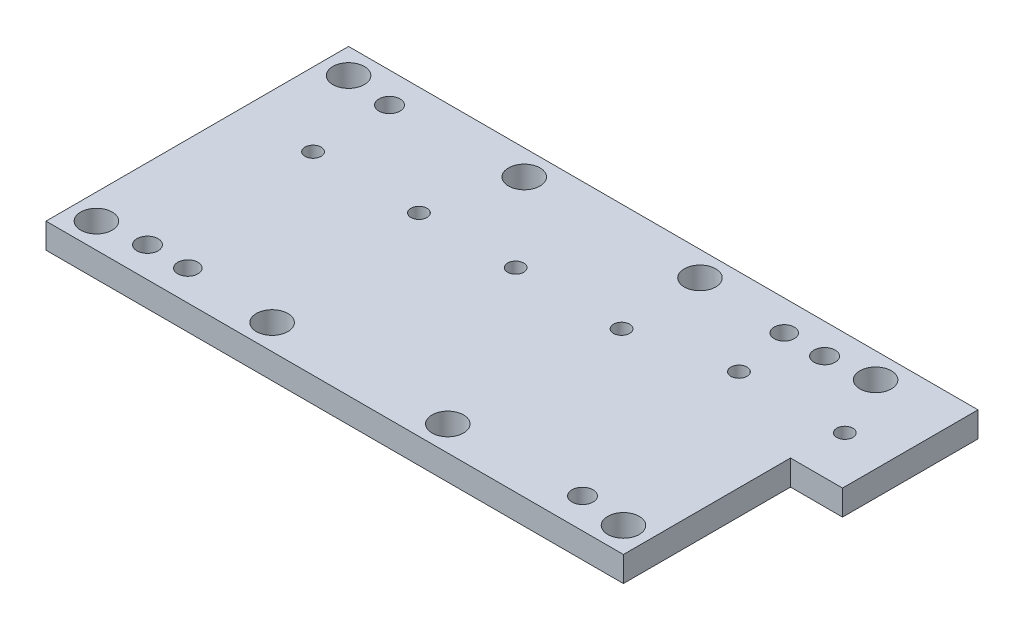
from build123d import *

# Parameters (mm, degrees)
SKETCH1_W                    = 229
SKETCH1_H                    = 120
BOSS_EXTRUDE1_DEPTH          = 10
SKETCH2_W                    = 20.632503002
SKETCH2_H                    = 53.730004003
BOSS_EXTRUDE2_DEPTH          = 10
F_12_5_12_5_DIAMETER_HOLE1_D = 12.5
M6_CLEARANCE_HOLE1_D         = 6.4
F_8_0MM_DOWEL_HOLE1_D        = 8
M8_CLEARANCE_HOLE1_D         = 8.4


with BuildPart() as part:
    # Sketch1 → Boss-Extrude1 (new body)
    with BuildSketch(Plane(origin=(0, 0, 0), x_dir=(1, 0, 0), z_dir=(0, 1, 0))):
        with Locations((-114.5, 0)):
            Rectangle(SKETCH1_W, SKETCH1_H)
    extrude(amount=-BOSS_EXTRUDE1_DEPTH)

    # Sketch2 → Boss-Extrude2 (add)
    with BuildSketch(Plane(origin=(0, 0, 0), x_dir=(1, 0, 0), z_dir=(0, 1, 0))):
        with Locations((10.316251501, 33.134997999)):
            Rectangle(SKETCH2_W, SKETCH2_H)
    extrude(amount=-BOSS_EXTRUDE2_DEPTH)

    # Ø12.5 (12.5) Diameter Hole1 (through all)
    with Locations(Plane(origin=(0, -10, 0), x_dir=(-1, 0, 0), z_dir=(0, -1, 0))):
        with Locations((9.969, 50), (79.812013925, 50.183768679), (149.323, 50), (219, 50), (219, -50), (149.323, -50), (79.646, -50), (9.969, -50)):
            Hole(F_12_5_12_5_DIAMETER_HOLE1_D / 2)

    # M6 Clearance Hole1 (through all)
    with Locations(Plane(origin=(0, -10, 0), x_dir=(-1, 0, 0), z_dir=(0, -1, 0))):
        with Locations((-2.125, 25.691000385), (39.875, 25.691000385), (77.875, 17.152366083), (119.875, 17.152366083), (157.875, 16.78), (199.875, 16.78)):
            Hole(M6_CLEARANCE_HOLE1_D / 2)

    # Ø8.0mm Dowel Hole1 (through all)
    with Locations(Plane(origin=(0, -10, 0), x_dir=(-1, 0, 0), z_dir=(0, -1, 0))):
        with Locations((184.75, -48), (44.219, 48)):
            Hole(F_8_0MM_DOWEL_HOLE1_D / 2)

    # M8 Clearance Hole1 (through all)
    with Locations(Plane(origin=(0, -10, 0), x_dir=(-1, 0, 0), z_dir=(0, -1, 0))):
        with Locations((28.219, 48), (200.75, 48), (200.75, -48), (28.219, -48)):
            Hole(M8_CLEARANCE_HOLE1_D / 2)


solid = part.part
